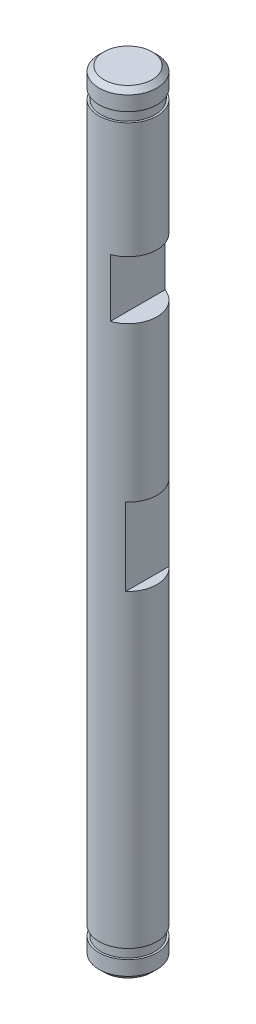
from build123d import *

# Parameters (mm, degrees)
CROQUIS1_R              = 3
SALIENTE_EXTRUIR1_DEPTH = 80
CROQUIS2_W              = 5.531234996
CROQUIS2_H              = 1
CORTAR_EXTRUIR1_REACH   = 83.112
CORTAR_EXTRUIR1_START   = 1
CROQUIS3_W              = 6
CROQUIS3_H              = 6
CORTAR_EXTRUIR3_REACH   = 84.112
CORTAR_EXTRUIR3_START   = -2
CROQUIS3_2_W            = 6
CROQUIS3_2_H            = 8
CORTAR_EXTRUIR4_REACH   = 84.112
CORTAR_EXTRUIR4_START   = 2
CROQUIS3_4_W            = 6
CROQUIS3_4_H            = 8
CHAFL_N1_SIZE           = 0.5


with BuildPart() as part:
    # Croquis1 → Saliente-Extruir1 (new body)
    with BuildSketch(Plane(origin=(0, 0, 0), x_dir=(1, 0, 0), z_dir=(0, 1, 0))):
        Circle(CROQUIS1_R)
    extrude(amount=SALIENTE_EXTRUIR1_DEPTH)

    # Croquis2 → Cortar-Revolución1 (revolve, cut)
    with BuildSketch(Plane.XY):
        with Locations((5.565617498, 77.5)):
            Rectangle(CROQUIS2_W, CROQUIS2_H)
        with Locations((5.565617498, 2.5)):
            Rectangle(CROQUIS2_W, CROQUIS2_H)
    revolve(axis=Axis((0, 80, 0), (0, -1, 0)), mode=Mode.SUBTRACT)

    # Croquis3 → Cortar-Extruir1 (cut, up to next)
    with BuildSketch(Plane(origin=(0, 0, 0), x_dir=(0, 0, -1), z_dir=(1, 0, 0)).offset(CORTAR_EXTRUIR1_START), mode=Mode.PRIVATE) as cortar_extruir1_sk1:
        with Locations((0, 62)):
            Rectangle(CROQUIS3_W, CROQUIS3_H)
    cortar_extruir1_tool1 = extrude(cortar_extruir1_sk1.sketch, amount=CORTAR_EXTRUIR1_REACH, mode=Mode.PRIVATE) & part.part
    add(cortar_extruir1_tool1.solids().sort_by_distance((1, 62, 0))[0], mode=Mode.SUBTRACT)

    # Croquis3<2> → Cortar-Extruir3 (cut, up to next)
    with BuildSketch(Plane(origin=(0, 0, 0), x_dir=(0, 0, -1), z_dir=(1, 0, 0)).offset(CORTAR_EXTRUIR3_START), mode=Mode.PRIVATE) as cortar_extruir3_sk1:
        with Locations((0, 39)):
            Rectangle(CROQUIS3_2_W, CROQUIS3_2_H)
    cortar_extruir3_tool1 = extrude(cortar_extruir3_sk1.sketch, amount=-CORTAR_EXTRUIR3_REACH, mode=Mode.PRIVATE) & part.part
    add(cortar_extruir3_tool1.solids().sort_by_distance((-2, 39, 0))[0], mode=Mode.SUBTRACT)

    # Croquis3<4> → Cortar-Extruir4 (cut, up to next)
    with BuildSketch(Plane(origin=(0, 0, 0), x_dir=(0, 0, -1), z_dir=(1, 0, 0)).offset(CORTAR_EXTRUIR4_START), mode=Mode.PRIVATE) as cortar_extruir4_sk1:
        with Locations((0, 39)):
            Rectangle(CROQUIS3_4_W, CROQUIS3_4_H)
    cortar_extruir4_tool1 = extrude(cortar_extruir4_sk1.sketch, amount=CORTAR_EXTRUIR4_REACH, mode=Mode.PRIVATE) & part.part
    add(cortar_extruir4_tool1.solids().sort_by_distance((2, 39, 0))[0], mode=Mode.SUBTRACT)

    # Chaflán1
    chafl_n1_edges = [part.edges().sort_by_distance(p)[0] for p in [
        (-3, 0, 0),
        (-3, 80, 0),
    ]]
    chamfer(chafl_n1_edges, length=CHAFL_N1_SIZE)


solid = part.part
